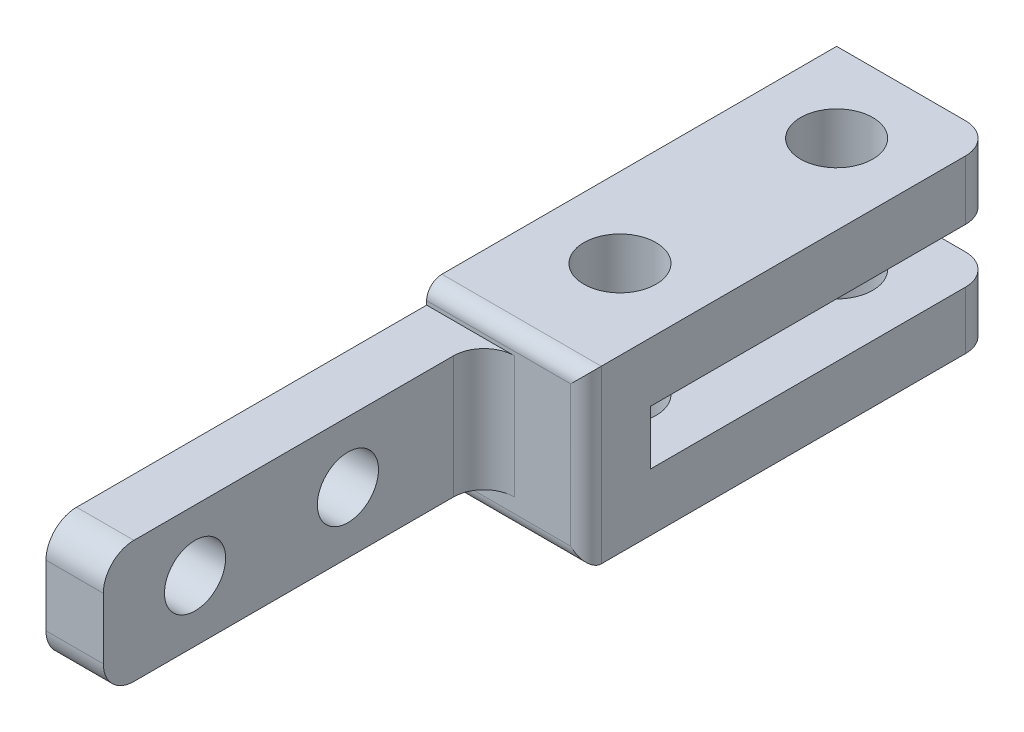
from build123d import *

# Parameters (mm, degrees)
SKETCH1_W                = 4.7625
SKETCH1_H                = 34.798
BOSS_EXTRUDE1_DEPTH      = 10.16
SKETCH2_R                = 2.54
CUT_EXTRUDE1_DEPTH       = 37.562382448
BOSS_EXTRUDE2_DEPTH      = 6.6675
BOSS_EXTRUDE2_DEPTH_BACK = 7.5565
SKETCH3_W                = 13.23848
SKETCH3_H                = 34.0614
SKETCH3_R                = 2.99974
SKETCH6_W                = 13.23848
SKETCH6_H                = 4.5085
CUT_EXTRUDE3_DEPTH       = 28.702
FILLET1_R                = 2.54
FILLET2_R                = 1.27


with BuildPart() as part:
    # Sketch1 → Boss-Extrude1 (new body)
    with BuildSketch(Plane(origin=(0, 0, 0), x_dir=(1, 0, 0), z_dir=(0, 1, 0))):
        with Locations((2.38125, -17.399)):
            Rectangle(SKETCH1_W, SKETCH1_H)
    extrude(amount=BOSS_EXTRUDE1_DEPTH)

    # Sketch2 → Cut-Extrude1 (cut, through all)
    with BuildSketch(Plane(origin=(4.7625, 0, 0), x_dir=(0, 0, -1), z_dir=(1, 0, 0))):
        with Locations((-27.178, 5.08)):
            Circle(SKETCH2_R)
        with Locations((-14.478, 5.08)):
            Circle(SKETCH2_R)
    extrude(amount=-CUT_EXTRUDE1_DEPTH, mode=Mode.SUBTRACT)

    # Sketch3 → Boss-Extrude2 (add, two sides: drawn at the far end of the back side and taken through both)
    with BuildSketch(Plane(origin=(0, 5.08, 0), x_dir=(1, 0, 0), z_dir=(0, 1, 0)).offset(-BOSS_EXTRUDE2_DEPTH_BACK)):
        with Locations((6.61924, 13.8557)):
            Rectangle(SKETCH3_W, SKETCH3_H)
        with Locations(Location((6.61924, 6.26618, 0), (0, 0, 270))):
            Circle(SKETCH3_R, mode=Mode.SUBTRACT)
        with Locations(Location((6.61924, 24.26716, 0), (0, 0, 270))):
            Circle(SKETCH3_R, mode=Mode.SUBTRACT)
    extrude(amount=BOSS_EXTRUDE2_DEPTH + BOSS_EXTRUDE2_DEPTH_BACK)

    # Sketch6 → Cut-Extrude3 (cut)
    with BuildSketch(Plane(origin=(0, 0, -30.8864), x_dir=(-1, 0, 0), z_dir=(0, 0, -1))):
        with Locations((-6.61924, 4.56311)):
            Rectangle(SKETCH6_W, SKETCH6_H)
    extrude(amount=-CUT_EXTRUDE3_DEPTH, mode=Mode.SUBTRACT)

    # Fillet1
    fillet1_edges = [part.edges().sort_by_distance(p)[0] for p in [
        (4.7625, 5.08, 3.175),
        (13.23848, -0.08382, -30.8864),
        (13.23848, 9.28243, -30.8864),
        (2.38125, 0, 34.798),
        (2.38125, 10.16, 34.798),
    ]]
    fillet(fillet1_edges, radius=FILLET1_R)

    # Fillet2
    fillet2_edges = [part.edges().sort_by_distance(p)[0] for p in [
        (6.61924, -2.4765, 3.175),
        (13.23848, 4.6355, 3.175),
        (6.61924, 11.7475, 3.175),
    ]]
    fillet(fillet2_edges, radius=FILLET2_R)


solid = part.part
